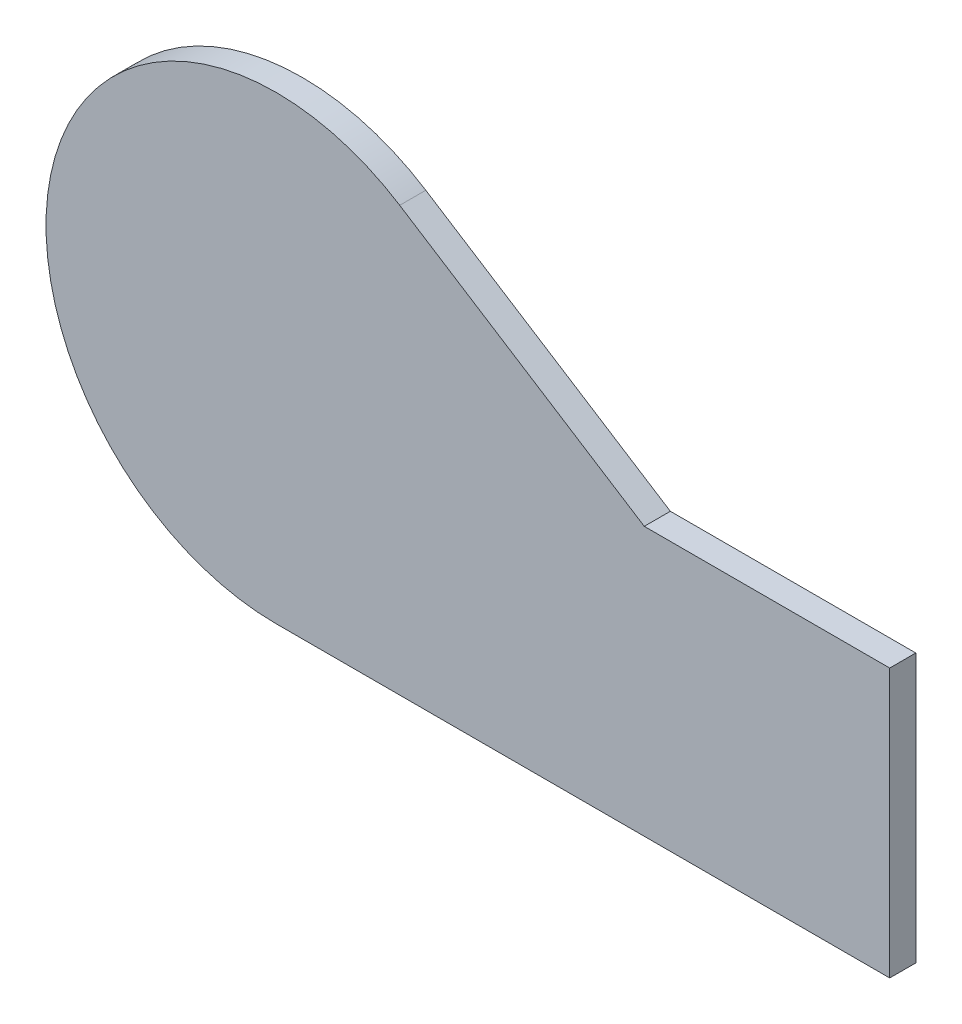
from build123d import *

# Parameters (mm, degrees)
BOSS_EXTRUDE1_DEPTH = 3.4


with BuildPart() as part:
    # Sketch1 → Boss-Extrude1 (new body)
    with BuildSketch(Plane.XY):
        with BuildLine():
            Line((0, -30), (80, -30))
            Line((80, -30), (80, 5))
            Line((80, 5), (48, 5))
            Line((48, 5), (16.114075804, 25.304872277))
            ThreePointArc((16.114075804, 25.304872277), (-28.802310396, 8.392074585), (0, -30))
        make_face()
    extrude(amount=BOSS_EXTRUDE1_DEPTH)


solid = part.part
